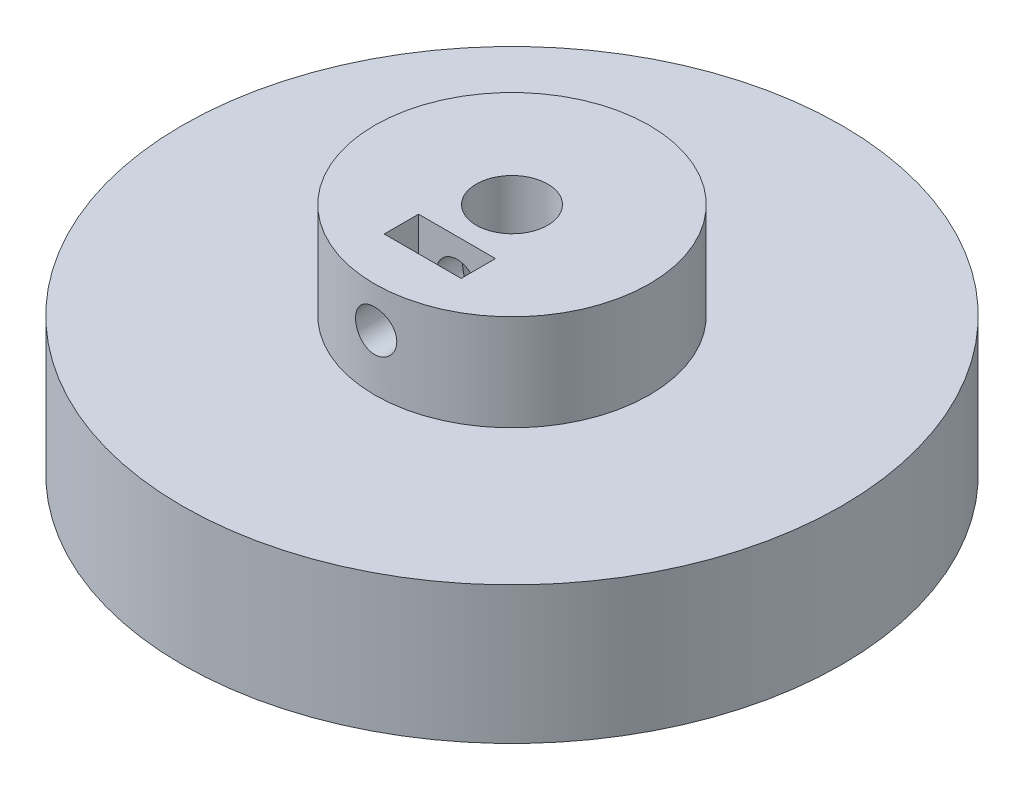
from build123d import *

# Parameters (mm, degrees)
PULLYBODY_R         = 24
PULLYBODY_R_2       = 2.6
BOSS_EXTRUDE1_DEPTH = 10
SKETCH2_R           = 10
SKETCH2_R_2         = 2.6
BOSS_EXTRUDE2_DEPTH = 7
SKETCH3_W           = 5.6
SKETCH3_H           = 2.5
CUT_EXTRUDE1_DEPTH  = 5.6
SKETCH4_R           = 1.5
CUT_EXTRUDE2_DEPTH  = 38.960505792


with BuildPart() as part:
    # PullyBody → Boss-Extrude1 (new body)
    with BuildSketch(Plane(origin=(0, 0, 0), x_dir=(1, 0, 0), z_dir=(0, 1, 0))):
        with Locations(Location((0, 0, 0), (0, 0, 270))):
            Circle(PULLYBODY_R)
        with Locations(Location((0, 0, 0), (0, 0, 270))):
            Circle(PULLYBODY_R_2, mode=Mode.SUBTRACT)
    extrude(amount=BOSS_EXTRUDE1_DEPTH)

    # Sketch2 → Boss-Extrude2 (add)
    with BuildSketch(Plane(origin=(0, 10, 0), x_dir=(1, 0, 0), z_dir=(0, 1, 0))):
        with Locations(Location((0, 0, 0), (0, 0, 270))):
            Circle(SKETCH2_R)
        with Locations(Location((0, 0, 0), (0, 0, 270))):
            Circle(SKETCH2_R_2, mode=Mode.SUBTRACT)
    extrude(amount=BOSS_EXTRUDE2_DEPTH)

    # Sketch3 → Cut-Extrude1 (cut)
    with BuildSketch(Plane(origin=(0, 17, 0), x_dir=(1, 0, 0), z_dir=(0, 1, 0))):
        with Locations((0, -5.25)):
            Rectangle(SKETCH3_W, SKETCH3_H)
    extrude(amount=-CUT_EXTRUDE1_DEPTH, mode=Mode.SUBTRACT)

    # Sketch4 → Cut-Extrude2 (cut, through all)
    with BuildSketch(Plane.XY):
        with Locations(Location((0, 14.05, 0), (0, 0, 180))):
            Circle(SKETCH4_R)
    extrude(amount=CUT_EXTRUDE2_DEPTH, mode=Mode.SUBTRACT)


solid = part.part
